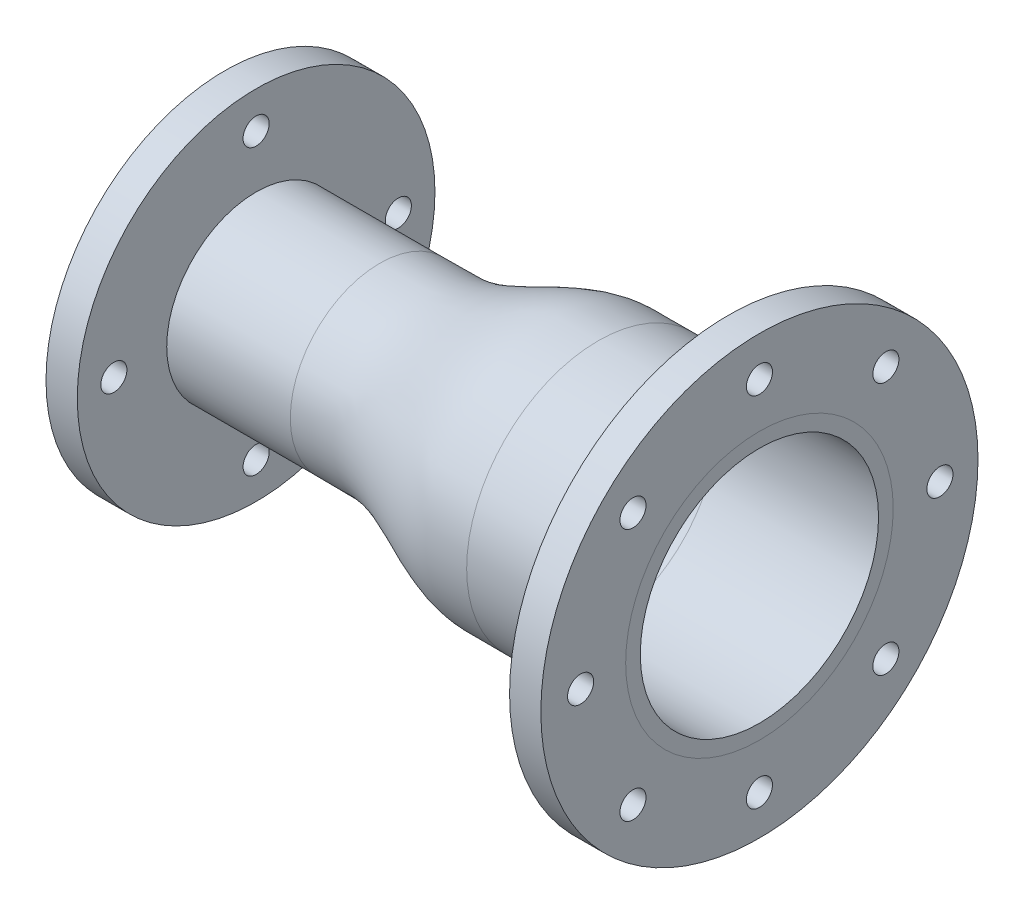
from build123d import *

# Parameters (mm, degrees)
F_5_8_CLEARANCE_HOLE1_D                             = 16.66748
F_5_8_CLEARANCE_HOLE1_DEPTH                         = 20
CSK_FOR_5_8_FLAT_HEAD_MACHINE_SCREW_100_D           = 16.66748
CSK_FOR_5_8_FLAT_HEAD_MACHINE_SCREW_100_DEPTH       = 20
CSK_FOR_5_8_FLAT_HEAD_MACHINE_SCREW_100_CSINK_D     = 32.3088
CSK_FOR_5_8_FLAT_HEAD_MACHINE_SCREW_100_CSINK_ANGLE = 100


with BuildPart() as part:
    # Sketch2 → Revolve1 (revolve)
    with BuildSketch(Plane.XY, mode=Mode.PRIVATE) as revolve1_sk:
        with BuildLine():
            Line((341.7, 76.137499212), (341.7, 139.7))
            Line((341.7, 139.7), (321.7, 139.7))
            Line((321.7, 139.7), (321.7, 84.137499212))
            Line((321.7, 84.137499212), (238.7, 84.137499212))
            add(Edge.make_bspline(
                [(238.7, 84.137499212), (238.355924075, 84.137499212), (237.667772223, 84.137499211), (236.43892963, 84.137499212), (234.866011112, 84.137499209), (233.096477778, 84.137499221), (231.179483334, 84.137499181), (229.409949997, 84.137499346), (227.492955565, 84.137498785), (225.723422181, 84.137501116), (223.806427909, 84.137493202), (222.03689386, 84.137526067), (220.119901847, 84.137414453), (218.350358415, 84.137877999), (216.436180482, 84.136306025), (214.671251811, 84.142808495), (212.761120781, 84.086749305), (210.997970421, 83.981894478), (209.088061418, 83.811610968), (207.325068085, 83.603702947), (205.415339805, 83.325577691), (203.652528826, 83.021476856), (201.742980231, 82.643054651), (199.980349522, 82.250081454), (198.070973132, 81.779589057), (196.308510241, 81.305636666), (194.399291637, 80.751921317), (192.636978054, 80.205434277), (190.727898375, 79.577923288), (188.965712472, 78.967858654), (187.056750607, 78.276511422), (185.294669761, 77.61229035), (183.385803915, 76.867540678), (181.623805854, 76.15899109), (179.715014471, 75.371680114), (177.95307795, 74.628970979), (176.044340155, 73.810271455), (174.28244512, 73.043839656), (172.373740784, 72.205172954), (170.611868192, 71.425644088), (168.701772289, 70.577967809), (166.937395899, 69.794959659), (165.024786727, 68.949453647), (163.259291454, 68.174390413), (161.346657228, 67.343861664), (159.58112861, 66.587981326), (157.668449277, 65.784003027), (155.902867536, 65.057899506), (153.990122343, 64.291832507), (152.22446654, 63.60586364), (150.311633974, 62.888769921), (148.545882008, 62.252980739), (146.632940071, 61.595543531), (144.867069113, 61.019596499), (142.95399603, 60.432048638), (141.187983586, 59.925161995), (139.274759098, 59.417223546), (137.508584813, 58.988118492), (135.595192141, 58.568944237), (133.828840435, 58.225800875), (131.915268777, 57.903938632), (130.148732425, 57.654357312), (128.234978669, 57.437727635), (126.468267149, 57.288649922), (124.789582716, 57.197477456), (123.443760708, 57.156958736), (122.420535806, 57.149027418), (121.677966993, 57.150148752), (120.601758891, 57.149831794), (119.202172332, 57.150049881), (117.285177742, 57.149983489), (115.515644452, 57.150003038), (113.598649997, 57.149998331), (111.829116667, 57.149999717), (109.912122221, 57.149999383), (108.142588888, 57.149999482), (106.225594444, 57.149999458), (104.45606111, 57.149999465), (102.539066666, 57.149999463), (101.039878703, 57.149999464), (99.81103611, 57.149999464), (99.27034537, 57.149999464), (98.999999999, 57.149999464)],
                knots=[0, 0, 0, 0, 0.007154165, 0.014308329, 0.025550588, 0.039858917, 0.051101176, 0.065409505, 0.076651764, 0.090960094, 0.102202352, 0.116510682, 0.12775294, 0.14206127, 0.153303528, 0.167554008, 0.178755429, 0.193030915, 0.204271905, 0.218620642, 0.229935227, 0.24439542, 0.255809505, 0.270408809, 0.281939941, 0.296695409, 0.308352907, 0.323271342, 0.335056718, 0.350135378, 0.362042998, 0.377270556, 0.389288475, 0.404646168, 0.416757099, 0.432220021, 0.44440238, 0.459940864, 0.472169892, 0.487750951, 0.499999862, 0.51562065, 0.52788688, 0.543480107, 0.55571106, 0.571242545, 0.583412274, 0.598850533, 0.610935794, 0.626253518, 0.638234915, 0.653410393, 0.66527347, 0.680291945, 0.692028204, 0.706883096, 0.718490902, 0.733184872, 0.744670204, 0.75921598, 0.770592966, 0.785013865, 0.796305044, 0.810635098, 0.821871343, 0.831256632, 0.838627865, 0.843146285, 0.846696472, 0.861004801, 0.87224706, 0.886555389, 0.897797648, 0.912105977, 0.923348236, 0.937656565, 0.948898824, 0.963207153, 0.974449412, 0.988757741, 0.994378871, 1, 1, 1, 1], degree=3, weights=[0.576132148, 0.576132148, 0.576132148, 0.576132148, 0.576132148, 0.576132148, 0.576132148, 0.576132148, 0.576132148, 0.576132148, 0.576132148, 0.576132148, 0.576132148, 0.576132148, 0.576132148, 0.576132148, 0.576132148, 0.576132148, 0.576132148, 0.576132148, 0.576132148, 0.576132148, 0.576132148, 0.576132148, 0.576132148, 0.576132148, 0.576132148, 0.576132148, 0.576132148, 0.576132148, 0.576132148, 0.576132148, 0.576132148, 0.576132148, 0.576132148, 0.576132148, 0.576132148, 0.576132148, 0.576132148, 0.576132148, 0.576132148, 0.576132148, 0.576132148, 0.576132148, 0.576132148, 0.576132148, 0.576132148, 0.576132148, 0.576132148, 0.576132148, 0.576132148, 0.576132148, 0.576132148, 0.576132148, 0.576132148, 0.576132148, 0.576132148, 0.576132148, 0.576132148, 0.576132148, 0.576132148, 0.576132148, 0.576132148, 0.576132148, 0.576132148, 0.576132148, 0.576132148, 0.576132148, 0.576132148, 0.576132148, 0.576132148, 0.576132148, 0.576132148, 0.576132148, 0.576132148, 0.576132148, 0.576132148, 0.576132148, 0.576132148, 0.576132148, 0.576132148, 0.576132148, 0.576132148]))
            Line((98.999999999, 57.149999464), (20, 57.149999464))
            Line((20, 57.149999464), (20, 114.3))
            Line((20, 114.3), (0, 114.3))
            Line((0, 114.3), (0, 49.149999464))
            Line((0, 49.149999464), (98.999999999, 49.149999464))
            add(Edge.make_bspline(
                [(238.700000001, 76.137499212), (235.69409428, 76.137499211), (231.185175342, 76.137529978), (225.92498116, 76.137458281), (222.918904328, 76.137568327), (220.664664612, 76.137283149), (218.784669959, 76.138023248), (217.290602157, 76.13677783), (216.128457097, 76.1382361), (215.066881493, 76.138852647), (213.792519107, 76.118938664), (211.496695076, 76.015652057), (208.229301379, 75.6893674), (204.270612611, 75.027164667), (200.298712296, 74.120693109), (194.985358164, 72.623109637), (188.321466773, 70.283294689), (180.275439823, 66.96143105), (172.126179657, 63.34551056), (163.790302615, 59.64532736), (155.164556548, 56.079333574), (147.64132386, 53.429737774), (141.378908996, 51.662061148), (136.556364248, 50.559794229), (131.615917341, 49.730227773), (127.403841781, 49.309288048), (124.437765649, 49.174559905), (122.930150126, 49.151400947), (122.100741829, 49.149426118), (121.356980871, 49.150399773), (120.417271001, 49.149754665), (118.913072261, 49.150117503), (117.035873074, 49.149952223), (114.780889972, 49.150013449), (111.775161973, 49.149990987), (106.514717734, 49.150005821), (102.005905795, 49.149999464), (98.999999999, 49.149999464)],
                knots=[0, 0, 0, 0, 0.0625, 0.09375, 0.109375, 0.125, 0.140625, 0.1484375, 0.15625, 0.1640625, 0.171875, 0.1875, 0.21875, 0.25, 0.28125, 0.3125, 0.375, 0.4375, 0.5, 0.5625, 0.625, 0.6875, 0.71875, 0.75, 0.78125, 0.8125, 0.828125, 0.8359375, 0.83984375, 0.84375, 0.8515625, 0.859375, 0.875, 0.890625, 0.90625, 0.9375, 1, 1, 1, 1], degree=3))
            Line((238.700000001, 76.137499212), (341.7, 76.137499212))
        make_face()
    revolve(revolve1_sk.sketch.rotate(Axis((341.7, 0, 0), (-1, 0, 0)), 90), axis=Axis((341.7, 0, 0), (-1, 0, 0)))

    # 5/8 Clearance Hole1
    with Locations(Plane(origin=(0, -86.94526051, 61.229912904), x_dir=(0, 0, 1), z_dir=(-1, 0, 0))):
        with Locations((-61.229912904, 177.798020209), (29.681467244, 86.94526051), (-61.229912904, -3.966119638), (-152.141293051, 86.94526051)):
            Hole(F_5_8_CLEARANCE_HOLE1_D / 2, depth=F_5_8_CLEARANCE_HOLE1_DEPTH)

    # CSK for 5_8 Flat Head Machine Screw _100
    with Locations(Plane(origin=(321.7, -86.94526051, 61.229912904), x_dir=(0, 0, 1), z_dir=(-1, 0, 0))):
        with Locations((-61.229912904, 201.24526051), (-176.596487394, 86.94526051), (-142.052217993, 167.767565599), (19.592392186, 167.767565599), (53.070087096, 86.94526051), (19.592392186, 6.12295542), (-61.229912904, -27.406492985), (-142.052217993, 6.12295542)):
            CounterSinkHole(CSK_FOR_5_8_FLAT_HEAD_MACHINE_SCREW_100_D / 2, CSK_FOR_5_8_FLAT_HEAD_MACHINE_SCREW_100_CSINK_D / 2, depth=CSK_FOR_5_8_FLAT_HEAD_MACHINE_SCREW_100_DEPTH, counter_sink_angle=CSK_FOR_5_8_FLAT_HEAD_MACHINE_SCREW_100_CSINK_ANGLE)


solid = part.part
